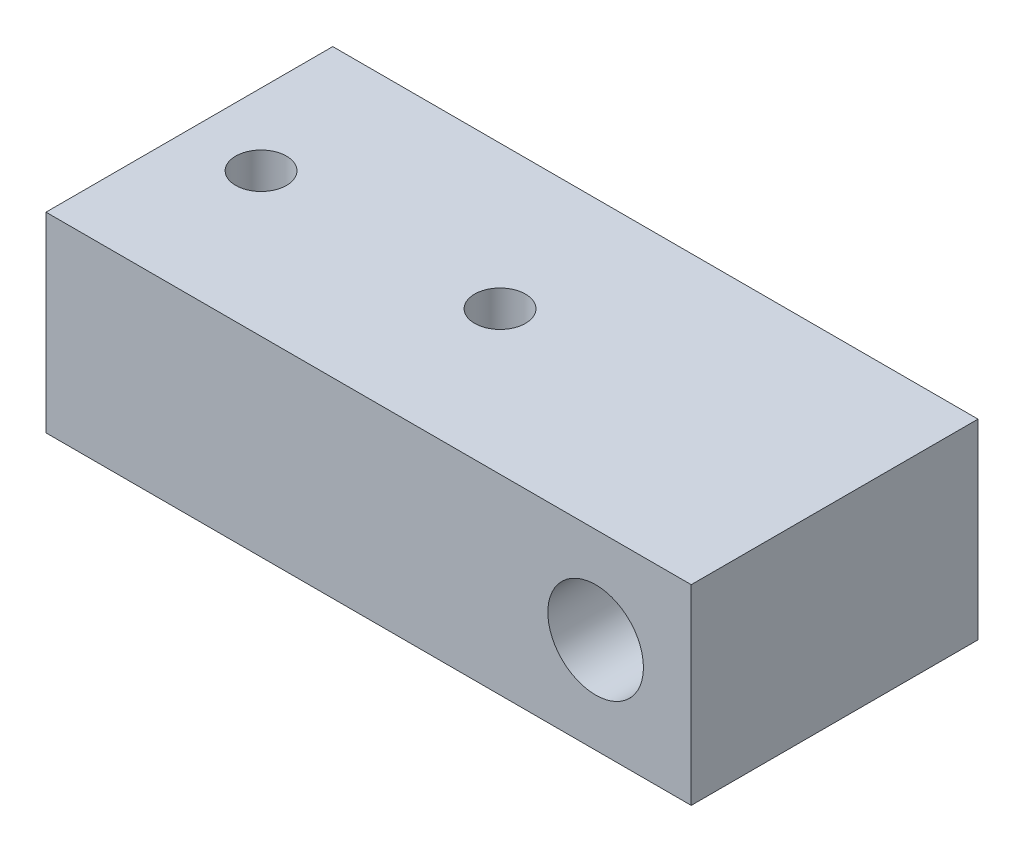
from build123d import *

# Parameters (mm, degrees)
SKETCH1_W                  = 85.725
SKETCH1_H                  = 38.1
BOSS_EXTRUDE1_DEPTH        = 12.7
F_1_2_0_5_DIAMETER_HOLE1_D = 12.7
F_1_4_CLEARANCE_HOLE1_D    = 6.7564


with BuildPart() as part:
    # Sketch1 → Boss-Extrude1 (new, symmetric)
    with BuildSketch(Plane(origin=(0, 0, 0), x_dir=(1, 0, 0), z_dir=(0, 1, 0))):
        Rectangle(SKETCH1_W, SKETCH1_H)
    extrude(amount=BOSS_EXTRUDE1_DEPTH, both=True)

    # 1/2 (0.5) Diameter Hole1 (through all)
    with Locations(Plane.XY.offset(19.05)):
        with Locations((30.1625, 0)):
            Hole(F_1_2_0_5_DIAMETER_HOLE1_D / 2)

    # 1/4 Clearance Hole1 (through all)
    with Locations(Plane(origin=(0, 12.7, 0), x_dir=(1, 0, 0), z_dir=(0, 1, 0))):
        with Locations((-33.3375, 0), (-1.5875, 0)):
            Hole(F_1_4_CLEARANCE_HOLE1_D / 2)


solid = part.part
